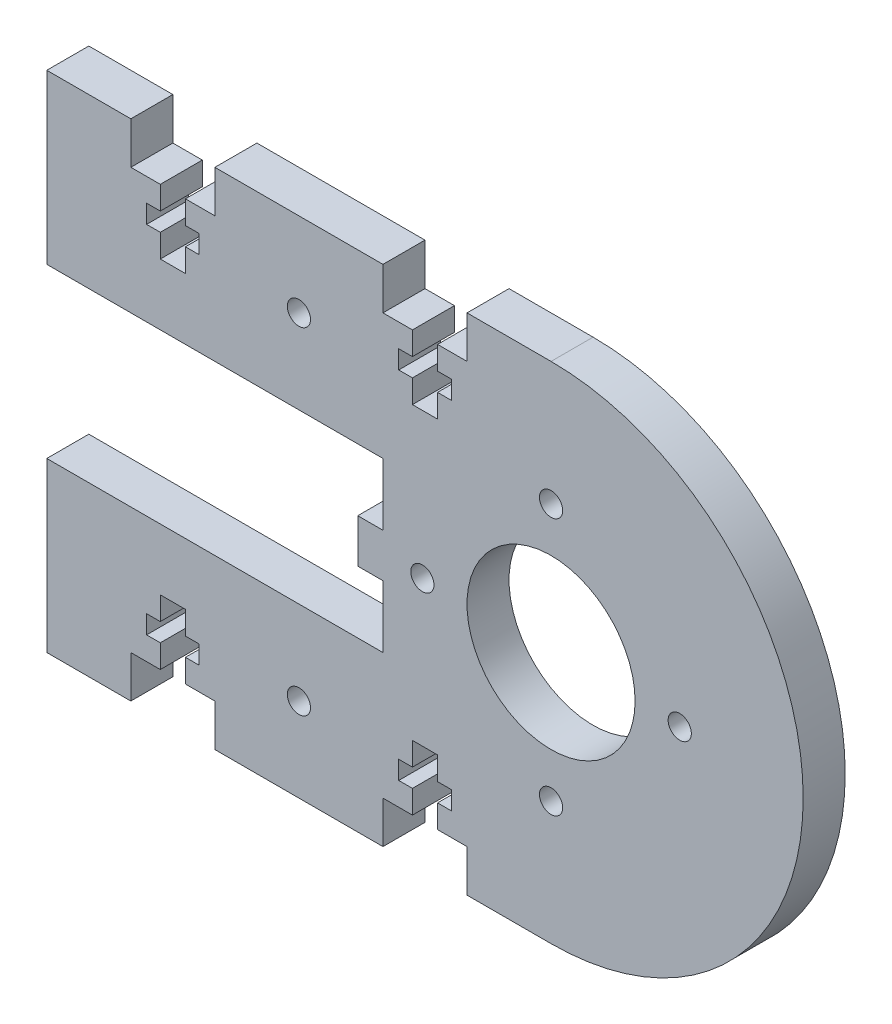
from build123d import *

# Parameters (mm, degrees)
BOSS_EXTRUDE1_DEPTH  = 6.35
SKETCH2_W            = 50.8
SKETCH2_H            = 25.4
CUT_EXTRUDE1_DEPTH   = 86.430512699
CUT_EXTRUDE2_DEPTH   = 6.35
LPATTERN1_COUNT      = 2
LPATTERN1_PITCH      = 38.1
SKETCH4_R            = 1.7526
CUT_EXTRUDE5_DEPTH   = 86.430512699
SKETCH6_W            = 6.35
SKETCH6_H            = 6.604
BOSS_EXTRUDE2_DEPTH  = 3.81
MIRROR4_COPY_1_DEPTH = 6.35
SKETCH5_R            = 12.7
CUT_EXTRUDE4_DEPTH   = 86.430512699
SKETCH7_R            = 1.7526
CUT_EXTRUDE6_DEPTH   = 86.430512699
CIRPATTERN1_COUNT    = 4


with BuildPart() as part:
    # Sketch1 → Boss-Extrude1 (new body)
    with BuildSketch(Plane.XY):
        with BuildLine():
            Line((-38.1, -38.1), (38.1, -38.1))
            ThreePointArc((38.1, -38.1), (76.2, 0), (38.1, 38.1))
            Line((38.1, 38.1), (-38.1, 38.1))
            Line((-38.1, 38.1), (-38.1, -38.1))
        make_face()
    extrude(amount=BOSS_EXTRUDE1_DEPTH)

    # Sketch2 → Cut-Extrude1 (cut, through all)
    with BuildSketch(Plane.XY.offset(6.35)):
        with Locations((-12.7, 0)):
            Rectangle(SKETCH2_W, SKETCH2_H)
    extrude(amount=-CUT_EXTRUDE1_DEPTH, mode=Mode.SUBTRACT)

    # Sketch3 → Cut-Extrude2 (cut)
    with BuildSketch(Plane.XY.offset(6.35)):
        Polygon((-25.4, -38.1), (-12.7, -38.1), (-12.7, -31.75), (-17.15135, -31.75), (-17.15135, -28.2495625), (-15.08125, -28.2495625), (-15.08125, -25.4714375), (-17.15135, -25.4714375), (-17.15135, -21.971), (-20.94865, -21.971), (-20.94865, -25.4714375), (-23.01875, -25.4714375), (-23.01875, -28.2495625), (-20.94865, -28.2495625), (-20.94865, -31.75), (-25.4, -31.75), align=None)
    cut_extrude2 = extrude(amount=-CUT_EXTRUDE2_DEPTH, mode=Mode.SUBTRACT)

    # LPattern1: Cut-Extrude2 ×2
    with Locations(*[(i * LPATTERN1_PITCH, 0, 0) for i in range(1, LPATTERN1_COUNT)]):
        add(cut_extrude2, mode=Mode.SUBTRACT)

    # Sketch4 → Cut-Extrude5 (cut, through all)
    with BuildSketch(Plane.XY.offset(6.35)):
        with Locations((0, -25.4)):
            Circle(SKETCH4_R)
    cut_extrude5 = extrude(amount=-CUT_EXTRUDE5_DEPTH, mode=Mode.SUBTRACT)

    # Sketch6 → Boss-Extrude2 (add)
    with BuildSketch(Plane.ZY.offset(-12.7)):
        with Locations((3.175, 0)):
            Rectangle(SKETCH6_W, SKETCH6_H)
    extrude(amount=BOSS_EXTRUDE2_DEPTH)

    # Mirror3: Cut-Extrude5 across plane
    add(cut_extrude5.mirror(Plane.ZX), mode=Mode.SUBTRACT)

    # Mirror4: Cut-Extrude2 across plane
    add(cut_extrude2.mirror(Plane.ZX), mode=Mode.SUBTRACT)

    # Mirror4 copy 1 sketch → Mirror4 copy 1 (cut)
    with BuildSketch(Plane(origin=(38.1, 0, 6.35), x_dir=(1, 0, 0), z_dir=(0, 0, 1))):
        Polygon((-25.4, 38.1), (-12.7, 38.1), (-12.7, 31.75), (-17.15135, 31.75), (-17.15135, 28.2495625), (-15.08125, 28.2495625), (-15.08125, 25.4714375), (-17.15135, 25.4714375), (-17.15135, 21.971), (-20.94865, 21.971), (-20.94865, 25.4714375), (-23.01875, 25.4714375), (-23.01875, 28.2495625), (-20.94865, 28.2495625), (-20.94865, 31.75), (-25.4, 31.75), align=None)
    extrude(amount=-MIRROR4_COPY_1_DEPTH, mode=Mode.SUBTRACT)

    # Sketch5 → Cut-Extrude4 (cut, through all)
    with BuildSketch(Plane.XY.offset(6.35)):
        with Locations((38.1, 0)):
            Circle(SKETCH5_R)
    extrude(amount=-CUT_EXTRUDE4_DEPTH, mode=Mode.SUBTRACT)

    # Sketch7 → Cut-Extrude6 (cut, through all)
    with BuildSketch(Plane.XY.offset(6.35)):
        with Locations((38.1, 19.4437)):
            Circle(SKETCH7_R)
    cut_extrude6 = extrude(amount=-CUT_EXTRUDE6_DEPTH, mode=Mode.SUBTRACT)

    # CirPattern1: Cut-Extrude6 ×4 about axis
    cirpattern1_axis = Axis((38.1, 0, 0), (0, 0, 1))
    for i in range(1, CIRPATTERN1_COUNT):
        add(cut_extrude6.rotate(cirpattern1_axis, i * 360 / CIRPATTERN1_COUNT), mode=Mode.SUBTRACT)


solid = part.part
